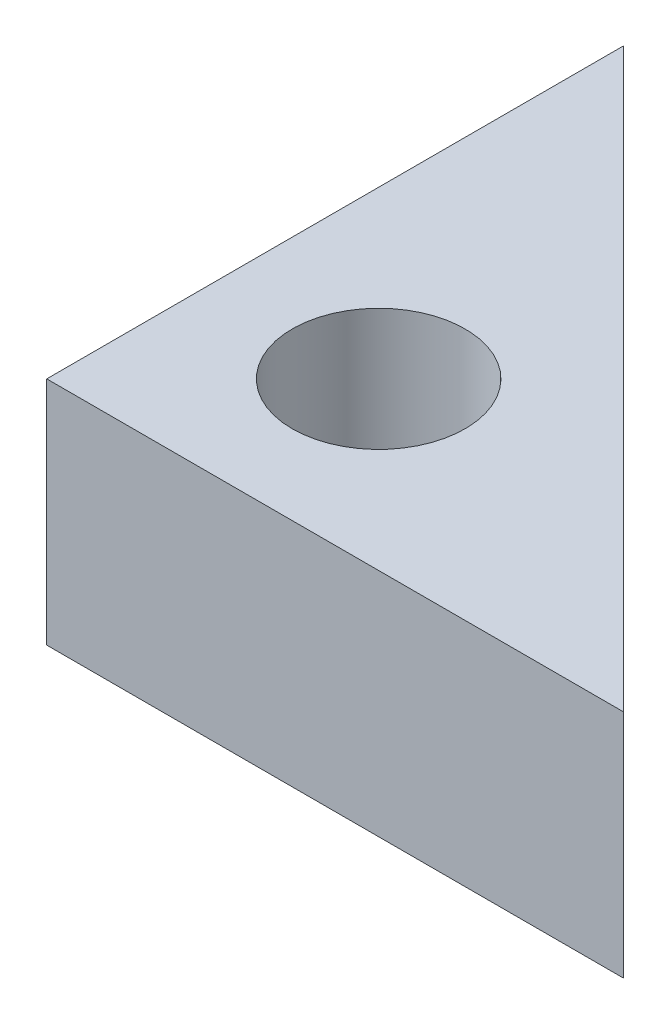
from build123d import *

# Parameters (mm, degrees)
SKETCH1_R           = 1.5
BOSS_EXTRUDE1_DEPTH = 4


with BuildPart() as part:
    # Sketch1 → Boss-Extrude1 (new body)
    with BuildSketch(Plane(origin=(0, 0, 0), x_dir=(1, 0, 0), z_dir=(0, 1, 0))):
        Polygon((0, 10), (0, 0), (10, 0), align=None)
        with Locations(Location((2.878679656, 2.878679656, 0), (0, 0, 270))):
            Circle(SKETCH1_R, mode=Mode.SUBTRACT)
    extrude(amount=BOSS_EXTRUDE1_DEPTH)


solid = part.part
